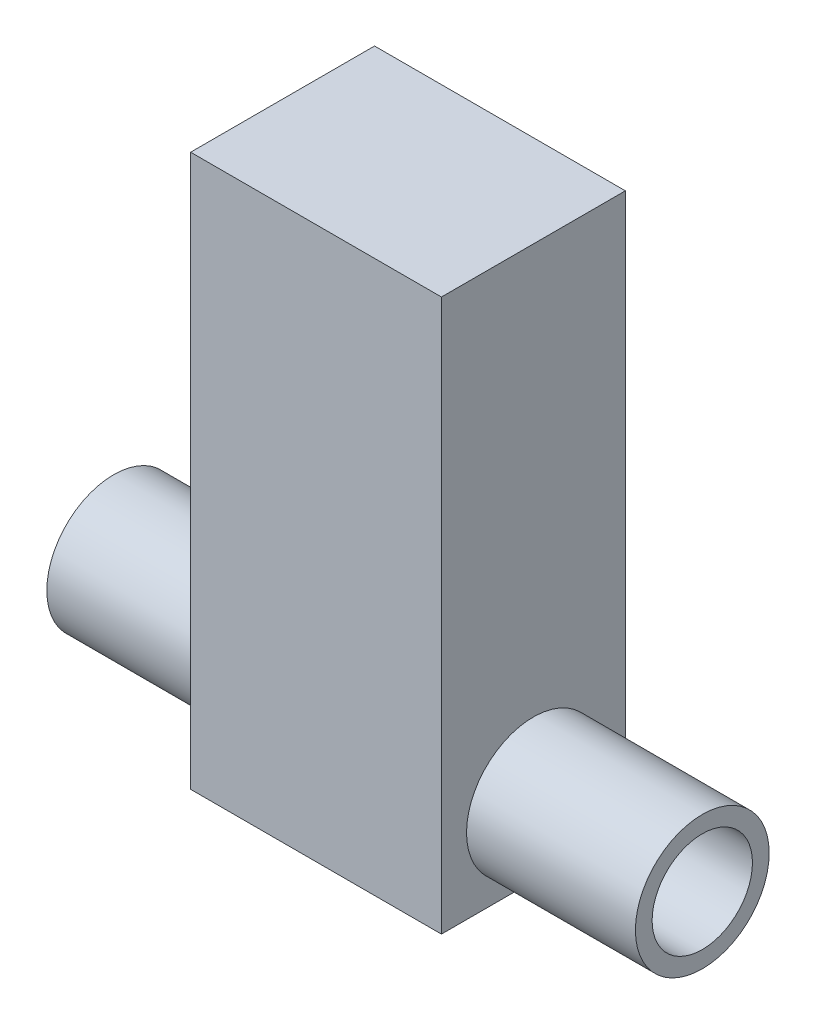
from build123d import *

# Parameters (mm, degrees)
SKETCH1_W           = 30
SKETCH1_H           = 22
BOSS_EXTRUDE1_DEPTH = 66
SKETCH2_R           = 8
BOSS_EXTRUDE2_DEPTH = 20.2
BOSS_EXTRUDE3_START = 20.2
SKETCH3_R           = 8
BOSS_EXTRUDE3_DEPTH = 20.2
SHELL1_T            = -2


with BuildPart() as part:
    # Sketch1 → Boss-Extrude1 (new body)
    with BuildSketch(Plane(origin=(0, 0, 0), x_dir=(1, 0, 0), z_dir=(0, 1, 0))):
        Rectangle(SKETCH1_W, SKETCH1_H)
    extrude(amount=BOSS_EXTRUDE1_DEPTH)

    # Sketch2 → Boss-Extrude2 (add)
    with BuildSketch(Plane.ZY.offset(15)):
        with Locations(Location((0, 9, 0), (0, 0, 180))):
            Circle(SKETCH2_R)
    extrude(amount=BOSS_EXTRUDE2_DEPTH)

    # Sketch3 → Boss-Extrude3 (add)
    with BuildSketch(Plane(origin=(15, 0, 0), x_dir=(0, 0, -1), z_dir=(1, 0, 0)).offset(BOSS_EXTRUDE3_START)):
        with Locations((0, 9)):
            Circle(SKETCH3_R)
    extrude(amount=-BOSS_EXTRUDE3_DEPTH)

    # Shell1
    shell1_openings = [part.faces().sort_by_distance(p)[0] for p in [
        (-35.2, 9, 0),
        (35.2, 9, 0),
    ]]
    offset(amount=SHELL1_T, openings=shell1_openings, kind=Kind.INTERSECTION)


solid = part.part
